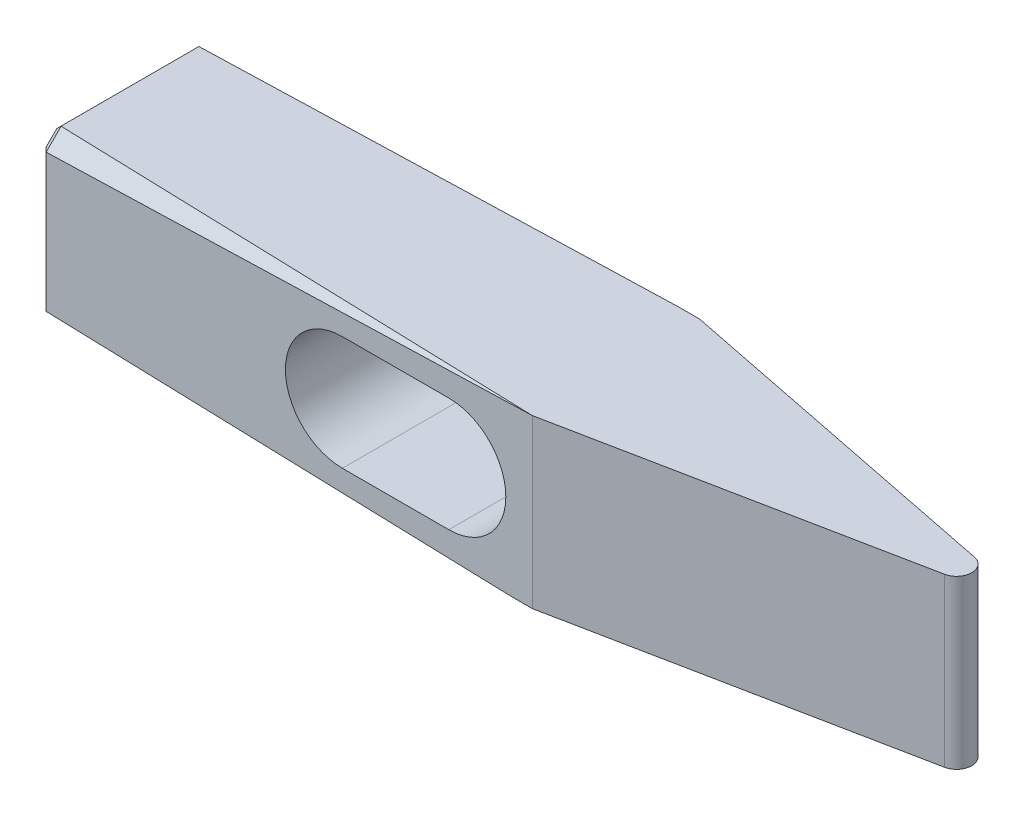
from build123d import *
from OCP.BRepFilletAPI import BRepFilletAPI_MakeChamfer

# Parameters (mm, degrees)
SKIZZE1_W                            = 120
SKIZZE1_H                            = 22
AUFSATZ_LINEAR_AUSTRAGEN1_DEPTH      = 22
SCHNITT_LINEAR_AUSTRAGEN1_DEPTH      = 124.967737738
SCHNITT_LINEAR_AUSTRAGEN1_DEPTH_BACK = 124.967737738
SCHNITT_LINEAR_AUSTRAGEN5_DEPTH      = 124.967737738
SCHNITT_LINEAR_AUSTRAGEN6_DEPTH      = 124.967737738
VERRUNDUNG1_R                        = 2
SCHNITT_LINEAR_AUSTRAGEN7_DEPTH      = 73.062472897
KREISMUSTER1_COUNT                   = 4
FASE1_SIZE                           = 1
FASE1_SIZE2                          = 1.022482955
SCHNITT_LINEAR_AUSTRAGEN8_DEPTH      = 10


with BuildPart() as part:
    # Skizze1 → Aufsatz-Linear austragen1 (new body)
    with BuildSketch(Plane.XY):
        with Locations((60, 11)):
            Rectangle(SKIZZE1_W, SKIZZE1_H)
    extrude(amount=AUFSATZ_LINEAR_AUSTRAGEN1_DEPTH)

    # Skizze2 → Schnitt-Linear austragen1 (cut, two sides: drawn at the far end of the back side and taken through both)
    with BuildSketch(Plane(origin=(0, 22, 0), x_dir=(1, 0, 0), z_dir=(0, 1, 0)).offset(-SCHNITT_LINEAR_AUSTRAGEN1_DEPTH_BACK)):
        Polygon((120, -11), (65, -22), (120, -22), align=None)
    extrude(amount=SCHNITT_LINEAR_AUSTRAGEN1_DEPTH + SCHNITT_LINEAR_AUSTRAGEN1_DEPTH_BACK, mode=Mode.SUBTRACT)

    # Skizze3 → Schnitt-Linear austragen5 (cut, through all)
    with BuildSketch(Plane.XZ):
        Polygon((120, 11), (65, 0), (120, 0), align=None)
    extrude(amount=-SCHNITT_LINEAR_AUSTRAGEN5_DEPTH, mode=Mode.SUBTRACT)

    # Skizze5 → Schnitt-Linear austragen6 (cut, through all)
    with BuildSketch(Plane(origin=(0, 0, 0), x_dir=(-1, 0, 0), z_dir=(0, 0, -1))):
        with BuildLine():
            Line((-54, 18.5), (-40, 18.5))
            ThreePointArc((-40, 18.5), (-32.5, 11), (-40, 3.5))
            Line((-40, 3.5), (-54, 3.5))
            ThreePointArc((-54, 3.5), (-61.5, 11), (-54, 18.5))
        make_face()
    extrude(amount=-SCHNITT_LINEAR_AUSTRAGEN6_DEPTH, mode=Mode.SUBTRACT)

    # Verrundung1
    verrundung1_edges = [part.edges().sort_by_distance(p)[0] for p in [
        (120, 11, 11),
    ]]
    fillet(verrundung1_edges, radius=VERRUNDUNG1_R)

    # 3D-Skizze1 → Schnitt-Linear austragen7 (cut, through all)
    with BuildSketch(Plane(origin=(65, 22, 22), x_dir=(-0.9995269630766537, 0, -0.03075467578697402), z_dir=(-0.02175198393938513, 0.7069394780300152, 0.7069394780300153))):
        Polygon((0, 0), (65.030761952, 0), (64.9692526, 2.827758229), align=None)
    schnitt_linear_austragen7 = extrude(amount=SCHNITT_LINEAR_AUSTRAGEN7_DEPTH, mode=Mode.SUBTRACT)

    # Kreismuster1: Schnitt-Linear austragen7 ×4 about axis
    kreismuster1_axis = Axis((0, 10.957123098, 10.957123098), (1, 0, 0))
    for i in range(1, KREISMUSTER1_COUNT):
        add(schnitt_linear_austragen7.rotate(kreismuster1_axis, i * 360 / KREISMUSTER1_COUNT), mode=Mode.SUBTRACT)

    # Fase1: one chamfer whose edges measure the first distance from different faces: ONE call of the kernel's chamfer builder (chamfer() names one face for all edges)
    fase1_edges_1 = [part.edges().sort_by_distance(p)[0] for p in [
        (0, 21, 21),
        (0, 0.957123098, 21.042876902),
        (0, 0.914246196, 0.914246196),
        (0, 21.042876902, 0.957123098),
    ]]
    fase1_side_1 = [part.faces().sort_by_distance(p)[0] for p in [
        (0, 10.993083294, 10.993083294),
    ]]
    fase1_edges_2 = [part.edges().sort_by_distance(p)[0] for p in [
        (0, 10.957123098, 22),
        (0, 0, 10.957123098),
        (0, 10.957123098, 0),
        (0, 22, 10.957123098),
    ]]
    fase1 = BRepFilletAPI_MakeChamfer(part.part.solid().wrapped)
    for e in fase1_edges_1:
        fase1.Add(FASE1_SIZE, FASE1_SIZE2, e.wrapped, fase1_side_1[0].wrapped)  # the first distance lies on this face
    for e in fase1_edges_2:
        fase1.Add(FASE1_SIZE, e.wrapped)
    add(Compound.cast(fase1.Shape()), mode=Mode.REPLACE)

    # Skizze6 → Schnitt-Linear austragen8 (cut)
    with BuildSketch(Plane.ZY):
        with BuildLine():
            Line((12.621096819, 12.381864671), (12.35186605, 12.126656338))
            add(Edge.make_bspline(
                [(12.35186605, 12.126656338), (12.303147162, 12.172487201), (12.206871115, 12.263056064), (12.049910873, 12.380567059), (11.886147239, 12.481233159), (11.716434742, 12.563139395), (11.544976188, 12.628492156), (11.374047412, 12.675020296), (11.20540171, 12.704692834), (11.093234492, 12.708241203), (11.037963806, 12.709989671)],
                knots=[0, 0, 0, 0, 1.08915593, 2.152340314, 3.188132944, 4.216796309, 5.218260357, 6.173443236, 7.099959455, 8, 8, 8, 8], degree=3))
            add(Edge.make_bspline(
                [(11.037963806, 12.709989671), (11.004049107, 12.709576065), (10.936307666, 12.708749926), (10.835685722, 12.698205711), (10.736119085, 12.683040847), (10.63779571, 12.661098969), (10.540524424, 12.63328991), (10.444643531, 12.598504446), (10.349974177, 12.557949202), (10.257408096, 12.511086728), (10.167667592, 12.459606882), (10.082910757, 12.402558341), (10.002597358, 12.341769551), (9.928236932, 12.275718572), (9.859401746, 12.205003707), (9.794453374, 12.1309404), (9.735676078, 12.051505182), (9.682584913, 11.968159556), (9.635223294, 11.882367367), (9.593414641, 11.794954377), (9.558317553, 11.706210523), (9.530548098, 11.616024445), (9.507637444, 11.525093855), (9.491519836, 11.432789134), (9.482433114, 11.339011449), (9.480861334, 11.276214191), (9.480071178, 11.24464512)],
                knots=[0, 0, 0, 0, 1.02818874, 2.053710826, 3.065248034, 4.081641283, 5.106893873, 6.131558223, 7.173050175, 8.228653731, 9.27666206, 10.308777013, 11.325269123, 12.329503258, 13.32196095, 14.316845687, 15.314881793, 16.315733098, 17.311955233, 18.285320748, 19.252783886, 20.203351036, 21.145449891, 22.095197417, 23.042428769, 24, 24, 24, 24], degree=3))
            add(Edge.make_bspline(
                [(9.480071178, 11.24464512), (9.480826897, 11.212374302), (9.482336269, 11.147920789), (9.491996589, 11.051726716), (9.509924829, 10.956961314), (9.533892538, 10.863313181), (9.563873354, 10.770621933), (9.60124602, 10.679289423), (9.645511621, 10.589319032), (9.696748173, 10.501521415), (9.752934376, 10.415998392), (9.815877457, 10.33543887), (9.88273804, 10.258770093), (9.95595194, 10.187694329), (10.033171483, 10.120310432), (10.116703759, 10.058474911), (10.204906219, 10.000996687), (10.297913431, 9.948600168), (10.394716213, 9.901791632), (10.493972966, 9.860167736), (10.596000782, 9.825888399), (10.700263472, 9.797950295), (10.806636743, 9.775049998), (10.915660546, 9.760317517), (11.026533254, 9.749626686), (11.101271887, 9.748845016), (11.138925345, 9.748451209)],
                knots=[0, 0, 0, 0, 0.93586088, 1.869166235, 2.799637598, 3.729985548, 4.670839027, 5.622275134, 6.589130586, 7.576015415, 8.568469353, 9.55398029, 10.53834874, 11.515998671, 12.510579167, 13.508179873, 14.527009472, 15.561807829, 16.601455013, 17.643573243, 18.680854198, 19.719860599, 20.772568776, 21.833555941, 22.908541556, 24, 24, 24, 24], degree=3))
            add(Edge.make_bspline(
                [(11.138925345, 9.748451209), (11.184303692, 9.749399786), (11.273411449, 9.751262469), (11.404397892, 9.765762759), (11.530200963, 9.788409553), (11.650467166, 9.821575449), (11.765336187, 9.863879124), (11.875229128, 9.914874511), (11.979280787, 9.97651757), (12.07780396, 10.046091437), (12.168561146, 10.123606269), (12.25041527, 10.207250724), (12.322060759, 10.296618791), (12.384565458, 10.391184106), (12.436274113, 10.491729411), (12.478716908, 10.597761974), (12.511250199, 10.709329486), (12.524605174, 10.786421118), (12.53135323, 10.825374286)],
                knots=[0, 0, 0, 0, 1.13008108, 2.219097802, 3.278683437, 4.311054135, 5.322181354, 6.324827112, 7.324222904, 8.330512327, 9.32562643, 10.293043162, 11.24128371, 12.174520618, 13.111833804, 14.052305215, 15.015860969, 16, 16, 16, 16], degree=3))
            Line((12.53135323, 10.825374286), (11.364686563, 10.825374286))
            Line((11.364686563, 10.825374286), (11.364686563, 11.184348645))
            Line((11.364686563, 11.184348645), (12.845455794, 11.184348645))
            add(Edge.make_bspline(
                [(12.845455794, 11.184348645), (12.843749945, 11.117441157), (12.840411292, 10.986491115), (12.816992376, 10.795520844), (12.779175864, 10.615149151), (12.727515552, 10.445186079), (12.660640272, 10.285872486), (12.579267743, 10.13704662), (12.482095622, 9.999669939), (12.372585181, 9.872620936), (12.249685223, 9.759291723), (12.116716603, 9.659685785), (11.973459635, 9.57578317), (11.820049827, 9.507522508), (11.656989394, 9.454248513), (11.483901014, 9.416476936), (11.301019413, 9.393846973), (11.175682736, 9.390955593), (11.111581595, 9.38947685)],
                knots=[0, 0, 0, 0, 1.140356446, 2.231883559, 3.274166699, 4.278491846, 5.25512956, 6.21435461, 7.1637429, 8.11826594, 9.068280886, 10.0076534, 10.945064095, 11.891975133, 12.864533718, 13.863980011, 14.907571808, 16, 16, 16, 16], degree=3))
            add(Edge.make_bspline(
                [(11.111581595, 9.38947685), (11.07207146, 9.390045972), (10.994144739, 9.391168462), (10.879053811, 9.39914581), (10.76713619, 9.411426386), (10.658408181, 9.429971509), (10.552469839, 9.452686164), (10.449850254, 9.481772882), (10.350158512, 9.515441582), (10.253240526, 9.553737255), (10.15997598, 9.598108912), (10.069949463, 9.647418551), (9.982663337, 9.701411912), (9.898712172, 9.761022758), (9.81765855, 9.825805218), (9.740025107, 9.895889137), (9.665377229, 9.971060257), (9.618616765, 10.024439266), (9.595055153, 10.051335825)],
                knots=[0, 0, 0, 0, 1.107784379, 2.184907829, 3.233506516, 4.263428166, 5.276301166, 6.270063455, 7.25232949, 8.225834625, 9.190232166, 10.146266622, 11.1027726, 12.066435141, 13.031522626, 14.010570082, 14.99756817, 16, 16, 16, 16], degree=3))
            add(Edge.make_bspline(
                [(9.595055153, 10.051335825), (9.560869221, 10.094006478), (9.493064808, 10.178639495), (9.405786651, 10.314239439), (9.331385249, 10.4546413), (9.271017426, 10.600235928), (9.22387934, 10.750887141), (9.190073087, 10.906402432), (9.170265798, 11.066982063), (9.167412261, 11.175647327), (9.165968614, 11.230622684)],
                knots=[0, 0, 0, 0, 1.023165419, 2.029347347, 3.013907458, 3.994755782, 4.975994455, 5.96558838, 6.970761222, 8, 8, 8, 8], degree=3))
            add(Edge.make_bspline(
                [(9.165968614, 11.230622684), (9.166500852, 11.271788937), (9.167558564, 11.353598244), (9.18038408, 11.475055551), (9.198785498, 11.594356244), (9.225832553, 11.7114028), (9.259928818, 11.826273392), (9.302482304, 11.939021355), (9.3520272, 12.049713227), (9.409612696, 12.157587095), (9.473697155, 12.261211508), (9.543247376, 12.360169311), (9.619250976, 12.452658376), (9.700466775, 12.539850024), (9.787863766, 12.620648871), (9.880623189, 12.695802982), (9.978816532, 12.765413168), (10.082752712, 12.828383003), (10.190880396, 12.884946623), (10.302940398, 12.934535835), (10.418898509, 12.97551915), (10.537885986, 13.01029293), (10.660803487, 13.036008071), (10.786759024, 13.054656816), (10.916409136, 13.067417416), (11.004045165, 13.068443671), (11.048480633, 13.06896403)],
                knots=[0, 0, 0, 0, 1.008945113, 2.00506715, 2.99143336, 3.967273523, 4.948097931, 5.927297278, 6.919902385, 7.919676788, 8.923139349, 9.905703106, 10.883022732, 11.856032218, 12.825136022, 13.798837087, 14.781400844, 15.773989409, 16.776158564, 17.77167057, 18.775803737, 19.789618931, 20.80898985, 21.851988756, 22.910860228, 24, 24, 24, 24], degree=3))
            add(Edge.make_bspline(
                [(11.048480633, 13.06896403), (11.084718877, 13.068384538), (11.156575056, 13.067235474), (11.263500788, 13.059270826), (11.368773803, 13.046646945), (11.472550193, 13.029420158), (11.574476559, 13.005956468), (11.674843264, 12.977878183), (11.7737958, 12.945186361), (11.87102405, 12.906197514), (11.967181766, 12.861943889), (12.062803606, 12.812130467), (12.157562852, 12.755905462), (12.251623834, 12.693101927), (12.345579691, 12.624798509), (12.437944334, 12.549041685), (12.530947278, 12.46881893), (12.590749092, 12.411136746), (12.621096819, 12.381864671)],
                knots=[0, 0, 0, 0, 0.985871117, 1.954866573, 2.915460327, 3.869826059, 4.81536089, 5.759505086, 6.70452669, 7.649098992, 8.607881297, 9.583363685, 10.581137262, 11.603961102, 12.659522466, 13.73993555, 14.853081303, 16, 16, 16, 16], degree=3))
        make_face()
        Polygon((13.563404512, 12.97922044), (13.877507076, 12.97922044), (13.877507076, 9.838194799), (15.223660922, 9.838194799), (15.223660922, 9.47922044), (13.563404512, 9.47922044), align=None)
    extrude(amount=-SCHNITT_LINEAR_AUSTRAGEN8_DEPTH, mode=Mode.SUBTRACT)


solid = part.part
